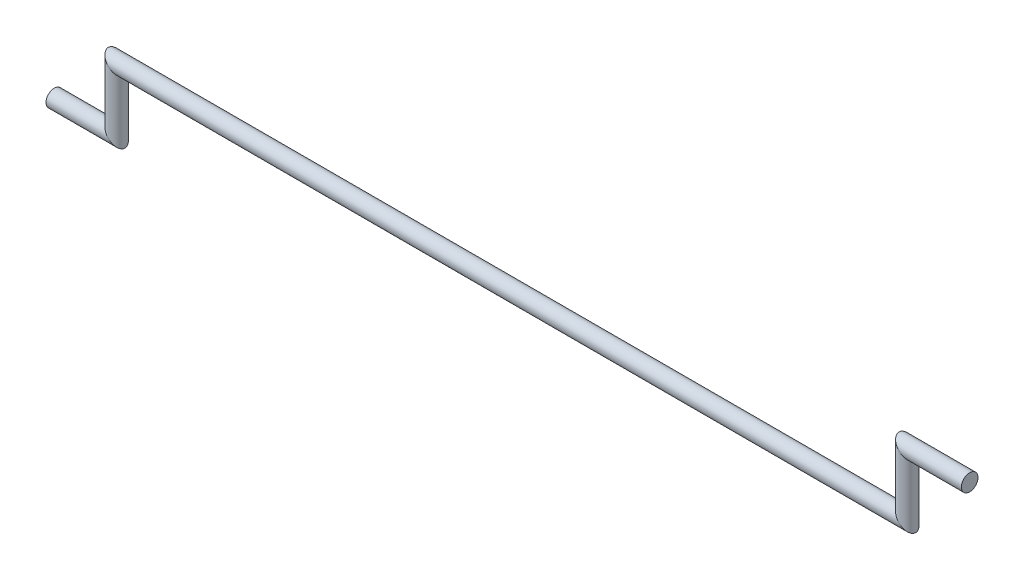
from build123d import *

# Parameters (mm, degrees)
SKETCH3_R = 0.4


with BuildPart() as part:
    # Sweep1: sweep along a path in Sketch2
    with BuildLine(Plane.XY) as sweep1_path:
        Line((0, 0), (3, 0))
        Line((3, 0), (3, 3))
        Line((3, 3), (41.05, 3))
        Line((41.05, 3), (41.05, 6))
        Line((41.05, 6), (44.05, 6))
    # Sketch3 → Sweep1 (sweep)
    with BuildSketch(Plane(origin=(0, 0, 0), x_dir=(0, 0, -1), z_dir=(1, 0, 0))):
        Circle(SKETCH3_R)
    sweep(path=sweep1_path.line, transition=Transition.RIGHT)


solid = part.part
